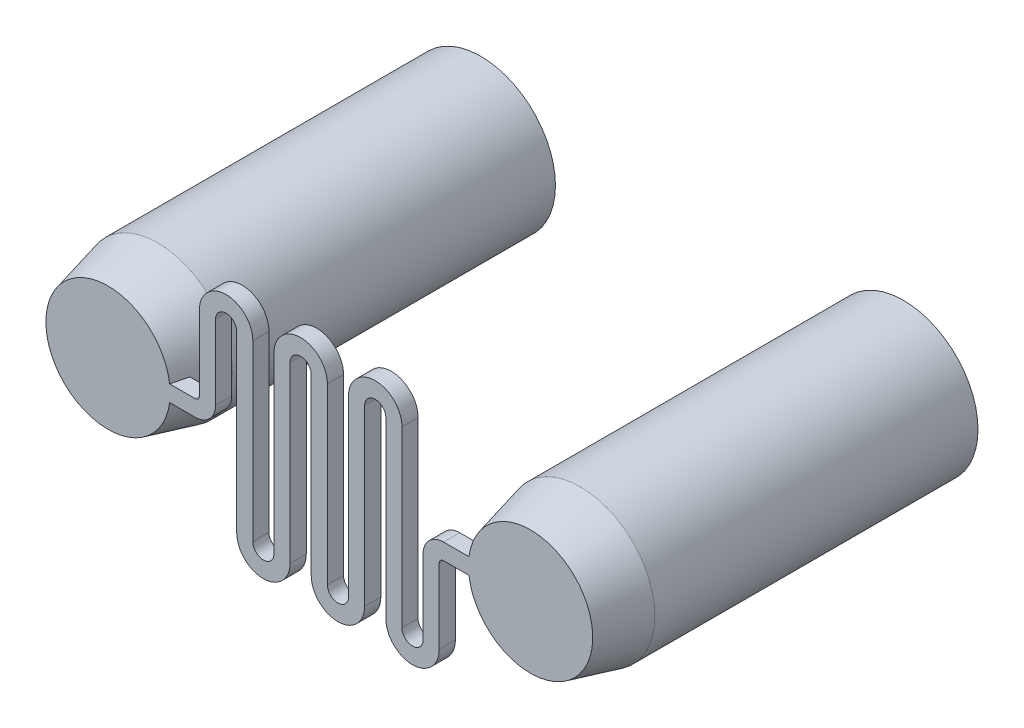
from build123d import *

# Parameters (mm, degrees)
BOSS_EXTRUDE1_DEPTH = 1.3
SKETCH5_R           = 5
CUT_EXTRUDE1_DEPTH  = 28


with BuildPart() as part:
    # Sketch2 → Boss-Extrude1 (new body)
    with BuildSketch(Plane.XY):
        with BuildLine():
            Line((-20.5, -0.65), (-13.5, -0.65))
            ThreePointArc((-13.5, -0.65), (-12.333273811, -0.166726189), (-11.85, 1))
            Line((-11.85, 1), (-11.85, 7))
            ThreePointArc((-11.85, 7), (-11, 7.85), (-10.15, 7))
            Line((-10.15, 7), (-10.15, 0))
            Line((-10.15, 0), (-10.15, -7))
            ThreePointArc((-10.15, -7), (-8, -9.15), (-5.85, -7))
            Line((-5.85, -7), (-5.85, 0))
            Line((-5.85, 0), (-5.85, 7))
            ThreePointArc((-5.85, 7), (-5, 7.85), (-4.15, 7))
            Line((-4.15, 7), (-4.15, 0))
            Line((-4.15, 0), (-4.15, -7))
            ThreePointArc((-4.15, -7), (-2, -9.15), (0.15, -7))
            Line((0.15, -7), (0.15, 0))
            Line((0.15, 0), (0.15, 7))
            ThreePointArc((0.15, 7), (1, 7.85), (1.85, 7))
            Line((1.85, 7), (1.85, 0))
            Line((1.85, 0), (1.85, -7))
            ThreePointArc((1.85, -7), (4, -9.15), (6.15, -7))
            Line((6.15, -7), (6.15, -1))
            ThreePointArc((6.15, -1), (6.252512627, -0.752512627), (6.5, -0.65))
            Line((6.5, -0.65), (13.5, -0.65))
            ThreePointArc((13.5, -0.65), (14.15, 0), (13.5, 0.65))
            Line((13.5, 0.65), (6.5, 0.65))
            ThreePointArc((6.5, 0.65), (5.333273811, 0.166726189), (4.85, -1))
            Line((4.85, -1), (4.85, -7))
            ThreePointArc((4.85, -7), (4, -7.85), (3.15, -7))
            Line((3.15, -7), (3.15, 0))
            Line((3.15, 0), (3.15, 7))
            ThreePointArc((3.15, 7), (1, 9.15), (-1.15, 7))
            Line((-1.15, 7), (-1.15, 0))
            Line((-1.15, 0), (-1.15, -7))
            ThreePointArc((-1.15, -7), (-2, -7.85), (-2.85, -7))
            Line((-2.85, -7), (-2.85, 0))
            Line((-2.85, 0), (-2.85, 7))
            ThreePointArc((-2.85, 7), (-5, 9.15), (-7.15, 7))
            Line((-7.15, 7), (-7.15, 0))
            Line((-7.15, 0), (-7.15, -7))
            ThreePointArc((-7.15, -7), (-8, -7.85), (-8.85, -7))
            Line((-8.85, -7), (-8.85, 0))
            Line((-8.85, 0), (-8.85, 7))
            ThreePointArc((-8.85, 7), (-11, 9.15), (-13.15, 7))
            Line((-13.15, 7), (-13.15, 1))
            ThreePointArc((-13.15, 1), (-13.252512627, 0.752512627), (-13.5, 0.65))
            Line((-13.5, 0.65), (-20.5, 0.65))
            ThreePointArc((-20.5, 0.65), (-21.15, 0), (-20.5, -0.65))
        make_face()
    extrude(amount=BOSS_EXTRUDE1_DEPTH)

    # Sketch3 → Revolve1 (revolve)
    with BuildSketch(Plane(origin=(0, 0, 0), x_dir=(1, 0, 0), z_dir=(0, 1, 0)), mode=Mode.PRIVATE) as revolve1_sk:
        Polygon((-20.5, -1.3), (-25.5, -1.3), (-26.5, 2.7), (-26.5, 28.7), (-20.5, 28.7), align=None)
    revolve(revolve1_sk.sketch.rotate(Axis((-20.5, 0, 1.3), (0, 0, -1)), 187.469592391), axis=Axis((-20.5, 0, 1.3), (0, 0, -1)))

    # Sketch4 → Revolve2 (revolve)
    with BuildSketch(Plane(origin=(0, 0, 0), x_dir=(1, 0, 0), z_dir=(0, 1, 0)), mode=Mode.PRIVATE) as revolve2_sk:
        Polygon((13.5, -1.3), (18.5, -1.3), (19.5, 2.7), (19.5, 28.7), (13.5, 28.7), align=None)
    revolve(revolve2_sk.sketch.rotate(Axis((13.5, 0, 1.3), (0, 0, -1)), 172.988663576), axis=Axis((13.5, 0, 1.3), (0, 0, -1)))

    # Sketch5 → Cut-Extrude1 (cut)
    with BuildSketch(Plane(origin=(0, 0, -28.7), x_dir=(-1, 0, 0), z_dir=(0, 0, -1))):
        with Locations((20.5, 0)):
            Circle(SKETCH5_R)
        with Locations((-13.5, 0)):
            Circle(SKETCH5_R)
    extrude(amount=-CUT_EXTRUDE1_DEPTH, mode=Mode.SUBTRACT)


solid = part.part
